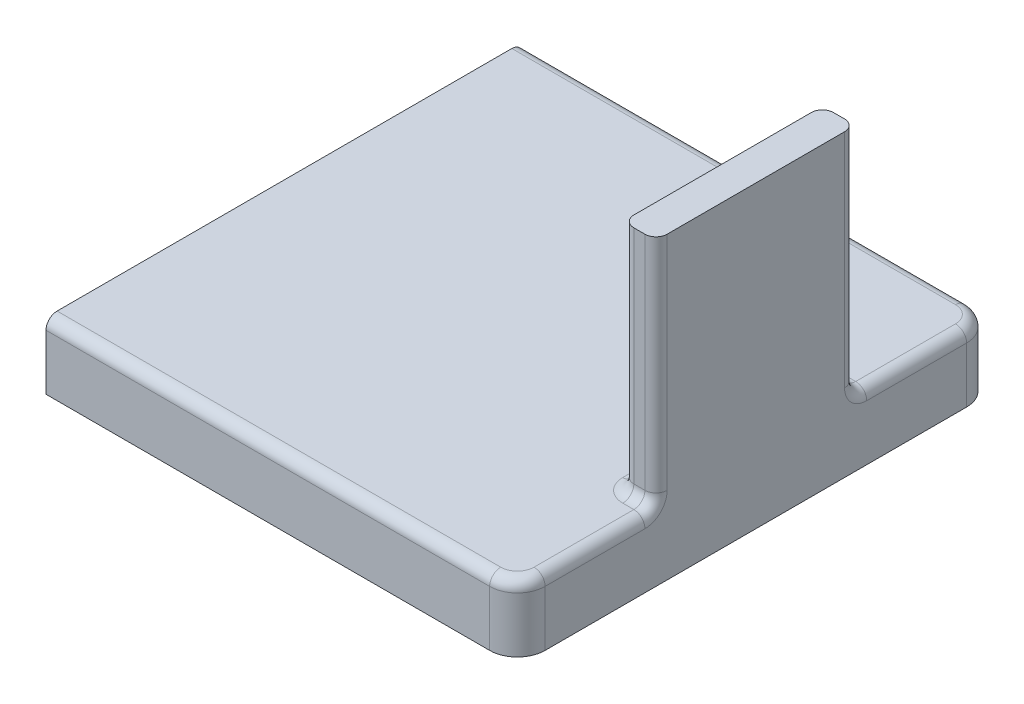
from build123d import *

# Parameters (mm, degrees)
SKETCH_1_W      = 85
SKETCH_1_H      = 12
EXTRUDE_1_DEPTH = 43
SKETCH_3_W      = 6
SKETCH_3_H      = 42
EXTRUDE_3_DEPTH = 18
FILLET_1_R      = 5
FILLET_2_R      = 2


with BuildPart() as part:
    # 草圖1 → 伸長1 (new, symmetric)
    with BuildSketch(Plane.XY):
        with Locations((42.5, -48)):
            Rectangle(SKETCH_1_W, SKETCH_1_H)
    extrude(amount=EXTRUDE_1_DEPTH, both=True)

    # 草圖3 → 伸長3 (add, symmetric)
    with BuildSketch(Plane.XY):
        with Locations((82, -21)):
            Rectangle(SKETCH_3_W, SKETCH_3_H)
    extrude(amount=EXTRUDE_3_DEPTH, both=True)

    # 圓角1
    fillet_1_edges = [part.edges().sort_by_distance(p)[0] for p in [
        (85, -48, -43),
        (85, -48, 43),
    ]]
    fillet(fillet_1_edges, radius=FILLET_1_R)

    # 圓角2
    fillet_2_edges = [part.edges().sort_by_distance(p)[0] for p in [
        (85, -42, -28),
        (82, -42, -18),
        (79, -42, 0),
        (85, -21, -18),
        (79, -21, -18),
        (82, -42, 18),
        (85, -21, 18),
        (79, -21, 18),
        (85, -42, 28),
        (40, -42, -43),
        (40, -42, 43),
        (83.535533906, -42, 41.535533906),
        (83.535533906, -42, -41.535533906),
    ]]
    fillet(fillet_2_edges, radius=FILLET_2_R)


solid = part.part
